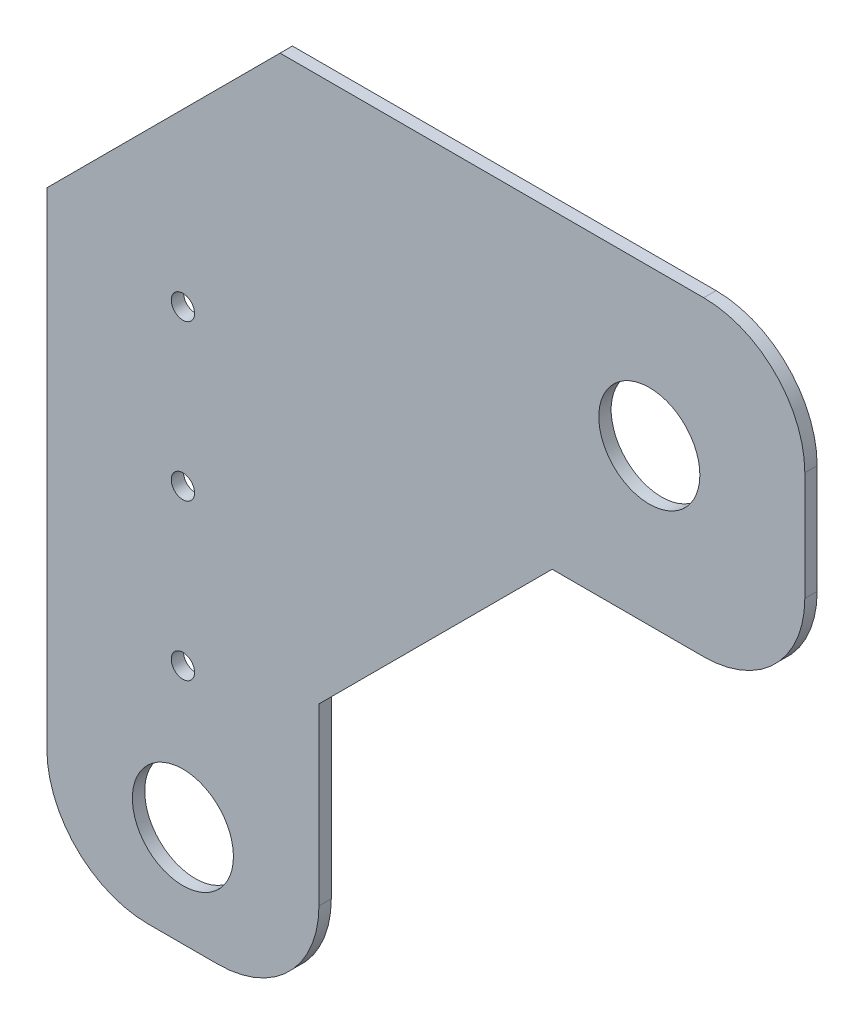
from build123d import *

# Parameters (mm, degrees)
SKETCH1_R           = 6.5
SKETCH1_R_2         = 1.5
BOSS_EXTRUDE1_DEPTH = 1.5875
FILLET2_R           = 13
CHAMFER1_SIZE       = 30


with BuildPart() as part:
    # Sketch1 → Boss-Extrude1 (new body)
    with BuildSketch(Plane.XY):
        Polygon((0, 0), (0, 50), (0, 79.5), (97.5, 79.5), (97.5, 39.5), (35, 39.5), (35, 0), (35, -26), (0, -26), align=None)
        with Locations((17.5, -13)):
            Circle(SKETCH1_R, mode=Mode.SUBTRACT)
        with Locations((77.5, 59.5)):
            Circle(SKETCH1_R, mode=Mode.SUBTRACT)
        with Locations((17.5, 45)):
            Circle(SKETCH1_R_2, mode=Mode.SUBTRACT)
        with Locations((17.5, 25)):
            Circle(SKETCH1_R_2, mode=Mode.SUBTRACT)
        with Locations((17.5, 5)):
            Circle(SKETCH1_R_2, mode=Mode.SUBTRACT)
    extrude(amount=BOSS_EXTRUDE1_DEPTH)

    # Fillet2
    fillet2_edges = [part.edges().sort_by_distance(p)[0] for p in [
        (97.5, 79.5, 0.79375),
        (97.5, 39.5, 0.79375),
        (35, -26, 0.79375),
        (0, -26, 0.79375),
    ]]
    fillet(fillet2_edges, radius=FILLET2_R)

    # Chamfer1
    chamfer1_edges = [part.edges().sort_by_distance(p)[0] for p in [
        (0, 79.5, 0.79375),
        (35, 39.5, 0.79375),
    ]]
    chamfer(chamfer1_edges, length=CHAMFER1_SIZE)


solid = part.part
